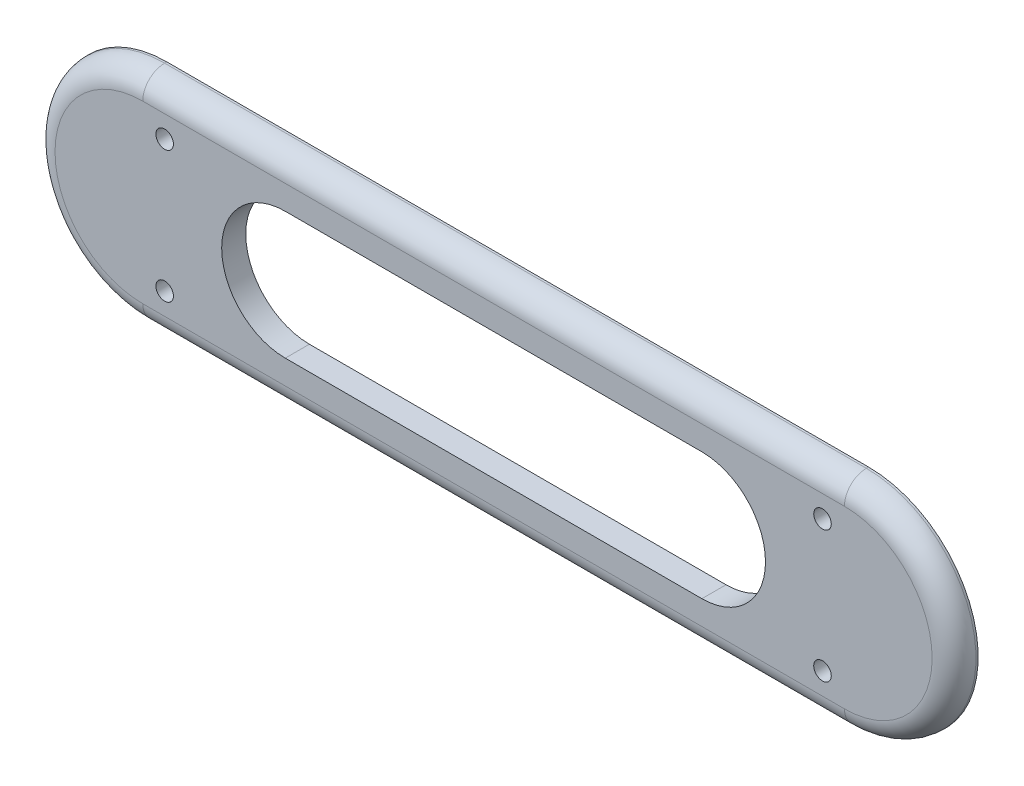
from build123d import *

# Parameters (mm, degrees)
SKETCH1_R           = 2
BOSS_EXTRUDE2_DEPTH = 5.5
FILLET1_R           = 5


with BuildPart() as part:
    # Sketch1 → Boss-Extrude2 (new body)
    with BuildSketch(Plane.XY):
        with BuildLine():
            Line((-80, -25), (80, -25))
            ThreePointArc((80, -25), (105, 0), (80, 25))
            Line((80, 25), (-80, 25))
            ThreePointArc((-80, 25), (-105, 0), (-80, -25))
        make_face()
        with Locations((-75, 15)):
            Circle(SKETCH1_R, mode=Mode.SUBTRACT)
        with Locations(Location((-75, -15, 0), (0, 0, 180))):
            Circle(SKETCH1_R, mode=Mode.SUBTRACT)
        with Locations((75, -15)):
            Circle(SKETCH1_R, mode=Mode.SUBTRACT)
        with Locations(Location((75, 15, 0), (0, 0, 180))):
            Circle(SKETCH1_R, mode=Mode.SUBTRACT)
        with BuildLine():
            Line((-47.5, 14.5), (47.5, 14.5))
            ThreePointArc((47.5, 14.5), (62, 0), (47.5, -14.5))
            Line((47.5, -14.5), (-47.5, -14.5))
            ThreePointArc((-47.5, -14.5), (-62, 0), (-47.5, 14.5))
        make_face(mode=Mode.SUBTRACT)
    extrude(amount=BOSS_EXTRUDE2_DEPTH)

    # Fillet1
    fillet1_edges = [part.edges().sort_by_distance(p)[0] for p in [
        (105, 0, 5.5),
        (0, 25, 5.5),
        (-105, 0, 5.5),
        (0, -25, 5.5),
    ]]
    fillet(fillet1_edges, radius=FILLET1_R)


solid = part.part
